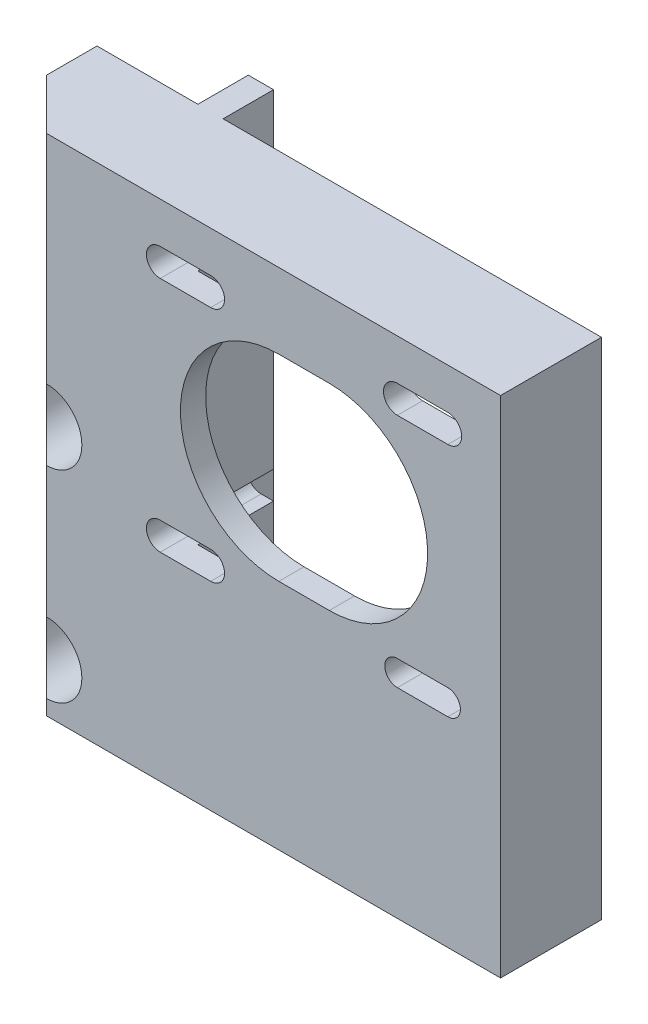
from build123d import *

# Parameters (mm, degrees)
SKETCH1_W           = 100
SKETCH1_H           = 100
BOSS_EXTRUDE1_DEPTH = 20
CUT_EXTRUDE1_DEPTH  = 20
SKETCH6_W           = 60
SKETCH6_H           = 90
CUT_EXTRUDE2_DEPTH  = 15
SKETCH2_W           = 5
SKETCH2_H           = 100
BOSS_EXTRUDE2_DEPTH = 10
CHAMFER1_SIZE       = 10
SKETCH7_R           = 3
CUT_EXTRUDE3_DEPTH  = 50
CUT_EXTRUDE4_START  = -10
SKETCH9_R           = 7
CUT_EXTRUDE4_DEPTH  = 50
LPATTERN1_COUNT     = 2
LPATTERN1_PITCH     = 40


with BuildPart() as part:
    # Sketch1 → Boss-Extrude1 (new body)
    with BuildSketch(Plane.XY):
        with Locations((-7.788018433, -1.33640553)):
            Rectangle(SKETCH1_W, SKETCH1_H)
    extrude(amount=BOSS_EXTRUDE1_DEPTH)

    # Sketch5 → Cut-Extrude1 (cut)
    with BuildSketch(Plane.XY.offset(20)):
        with BuildLine():
            Line((31.754288081, -11.717886794), (21.754288081, -11.717886794))
            ThreePointArc((21.754288081, -11.717886794), (19.254288081, -9.217886794), (21.754288081, -6.717886794))
            Line((21.754288081, -6.717886794), (31.754288081, -6.717886794))
            ThreePointArc((31.754288081, -6.717886794), (34.254288081, -9.217886794), (31.754288081, -11.717886794))
        make_face()
        with BuildLine():
            Line((8.254288081, -5.217886794), (-1.745711919, -5.217886794))
            ThreePointArc((-1.745711919, -5.217886794), (-21.245711919, 14.282113206), (-1.745711919, 33.782113206))
            Line((-1.745711919, 33.782113206), (8.254288081, 33.782113206))
            ThreePointArc((8.254288081, 33.782113206), (27.754288081, 14.282113206), (8.254288081, -5.217886794))
        make_face()
        with BuildLine():
            Line((31.754288081, 35.035010382), (21.754288081, 35.035010382))
            ThreePointArc((21.754288081, 35.035010382), (19.007185257, 37.782113206), (21.754288081, 40.52921603))
            Line((21.754288081, 40.52921603), (31.754288081, 40.52921603))
            ThreePointArc((31.754288081, 40.52921603), (34.501390905, 37.782113206), (31.754288081, 35.035010382))
        make_face()
        with BuildLine():
            Line((-15.245711919, 35.035010382), (-25.245711919, 35.035010382))
            ThreePointArc((-25.245711919, 35.035010382), (-27.992814743, 37.782113206), (-25.245711919, 40.52921603))
            Line((-25.245711919, 40.52921603), (-15.245711919, 40.52921603))
            ThreePointArc((-15.245711919, 40.52921603), (-12.498609095, 37.782113206), (-15.245711919, 35.035010382))
        make_face()
        with BuildLine():
            Line((-15.245711919, -11.964989618), (-25.245711919, -11.964989618))
            ThreePointArc((-25.245711919, -11.964989618), (-27.992814743, -9.217886794), (-25.245711919, -6.47078397))
            Line((-25.245711919, -6.47078397), (-15.245711919, -6.47078397))
            ThreePointArc((-15.245711919, -6.47078397), (-12.498609095, -9.217886794), (-15.245711919, -11.964989618))
        make_face()
    extrude(amount=-CUT_EXTRUDE1_DEPTH, mode=Mode.SUBTRACT)

    # Sketch6 → Cut-Extrude2 (cut)
    with BuildSketch(Plane(origin=(0, 0, 0), x_dir=(-1, 0, 0), z_dir=(0, 0, -1))):
        with Locations((-7.211981567, -1.33640553)):
            Rectangle(SKETCH6_W, SKETCH6_H)
    extrude(amount=-CUT_EXTRUDE2_DEPTH, mode=Mode.SUBTRACT)

    # Sketch2 → Boss-Extrude2 (add)
    with BuildSketch(Plane(origin=(0, 0, 0), x_dir=(-1, 0, 0), z_dir=(0, 0, -1))):
        with Locations((35.288018433, -1.33640553)):
            Rectangle(SKETCH2_W, SKETCH2_H)
    extrude(amount=BOSS_EXTRUDE2_DEPTH)

    # Chamfer1
    chamfer1_edges = [part.edges().sort_by_distance(p)[0] for p in [
        (-57.788018433, -1.33640553, 20),
    ]]
    chamfer(chamfer1_edges, length=CHAMFER1_SIZE)

    # Sketch7 → Cut-Extrude3 (cut)
    with BuildSketch(Plane(origin=(0, 0, 0), x_dir=(-1, 0, 0), z_dir=(0, 0, -1))):
        with Locations((47.788018433, -41.33640553)):
            Circle(SKETCH7_R)
    cut_extrude3 = extrude(amount=-CUT_EXTRUDE3_DEPTH, mode=Mode.SUBTRACT)

    # Sketch9 → Cut-Extrude4 (cut)
    with BuildSketch(Plane(origin=(0, 0, 0), x_dir=(-1, 0, 0), z_dir=(0, 0, -1)).offset(CUT_EXTRUDE4_START)):
        with Locations((47.788018433, -41.33640553)):
            Circle(SKETCH9_R)
    cut_extrude4 = extrude(amount=-CUT_EXTRUDE4_DEPTH, mode=Mode.SUBTRACT)

    # LPattern1: Cut-Extrude3, Cut-Extrude4 ×2
    with Locations(*[(0, i * LPATTERN1_PITCH, 0) for i in range(1, LPATTERN1_COUNT)]):
        add(cut_extrude3, mode=Mode.SUBTRACT)
        add(cut_extrude4, mode=Mode.SUBTRACT)


solid = part.part
